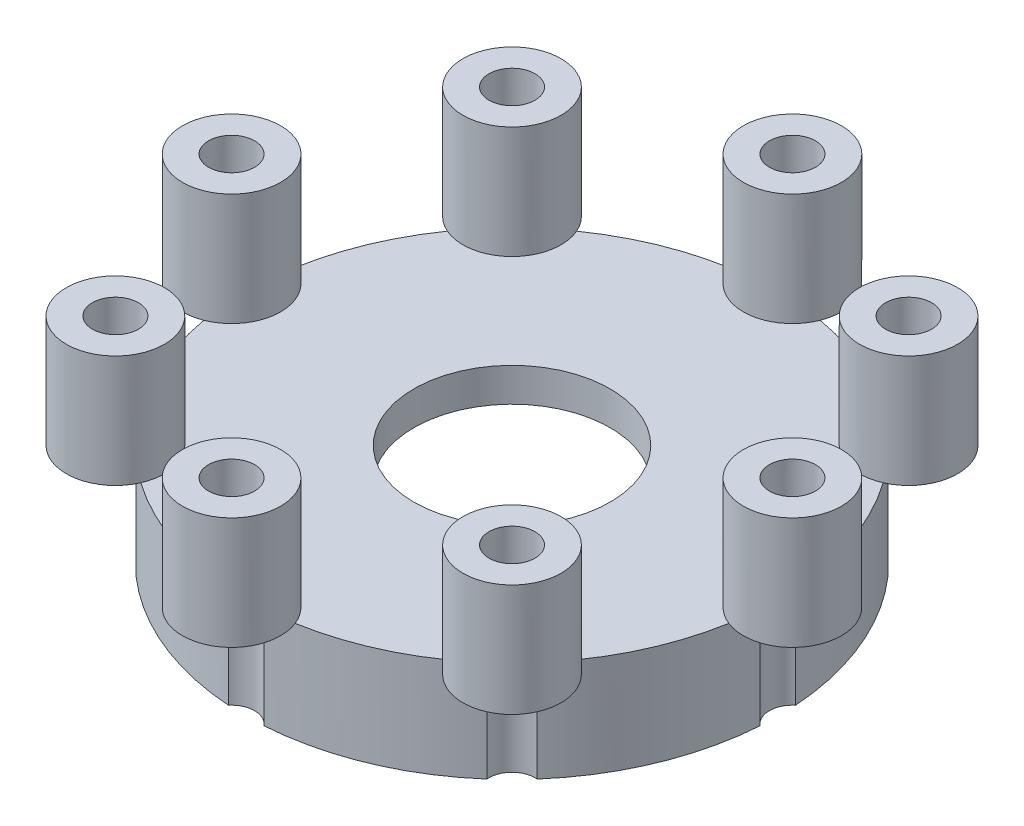
from build123d import *

# Parameters (mm, degrees)
SKETCH3_R               = 8.75
BOSS_EXTRUDE1_DEPTH     = 20
CUT_EXTRUDE1_DEPTH      = 92.362601758
CUT_EXTRUDE1_DEPTH_BACK = 92.362601758
SKETCH4_R               = 4.1
SKETCH5_R               = 6.880501159
CUT_EXTRUDE2_DEPTH      = 10


with BuildPart() as part:
    # Sketch2 → Revolve1 (revolve)
    with BuildSketch(Plane(origin=(0, 0, 0), x_dir=(0, 0, -1), z_dir=(1, 0, 0))):
        Polygon((-47.5, 9), (-47.5, -9), (-42.5, -9), (-42.5, 3), (-17.5, 3), (-17.5, 9), align=None)
    revolve(axis=Axis((0, 40.533381554, 0), (0, -1, 0)))

    # Sketch3 → Boss-Extrude1 (add)
    with BuildSketch(Plane(origin=(0, 9, 0), x_dir=(1, 0, 0), z_dir=(0, 1, 0))):
        with Locations(Location((0, 50, 0), (0, 0, 201.473535129))):
            Circle(SKETCH3_R)
        with Locations(Location((35.355339059, 35.355339059, 0), (0, 0, 156.473535129))):
            Circle(SKETCH3_R)
        with Locations(Location((50, 0, 0), (0, 0, 111.473535129))):
            Circle(SKETCH3_R)
        with Locations(Location((35.355339059, -35.355339059, 0), (0, 0, 66.473535129))):
            Circle(SKETCH3_R)
        with Locations(Location((0, -50, 0), (0, 0, 158.526464871))):
            Circle(SKETCH3_R)
        with Locations(Location((-35.355339059, -35.355339059, 0), (0, 0, 113.526464871))):
            Circle(SKETCH3_R)
        with Locations(Location((-50, 0, 0), (0, 0, 68.526464871))):
            Circle(SKETCH3_R)
        with Locations(Location((-35.355339059, 35.355339059, 0), (0, 0, 23.526464871))):
            Circle(SKETCH3_R)
    extrude(amount=BOSS_EXTRUDE1_DEPTH)

    # Sketch4 → Cut-Extrude1 (cut, two sides: drawn at the far end of the back side and taken through both)
    with BuildSketch(Plane(origin=(0, 29, 0), x_dir=(1, 0, 0), z_dir=(0, 1, 0)).offset(-CUT_EXTRUDE1_DEPTH_BACK)):
        with Locations(Location((0, 50, 0), (0, 0, 270))):
            Circle(SKETCH4_R)
        with Locations(Location((35.355339059, 35.355339059, 0), (0, 0, 270))):
            Circle(SKETCH4_R)
        with Locations(Location((50, 0, 0), (0, 0, 270))):
            Circle(SKETCH4_R)
        with Locations(Location((35.355339059, -35.355339059, 0), (0, 0, 270))):
            Circle(SKETCH4_R)
        with Locations(Location((0, -50, 0), (0, 0, 270))):
            Circle(SKETCH4_R)
        with Locations(Location((-35.355339059, -35.355339059, 0), (0, 0, 270))):
            Circle(SKETCH4_R)
        with Locations(Location((-50, 0, 0), (0, 0, 270))):
            Circle(SKETCH4_R)
        with Locations(Location((-35.355339059, 35.355339059, 0), (0, 0, 270))):
            Circle(SKETCH4_R)
    extrude(amount=CUT_EXTRUDE1_DEPTH + CUT_EXTRUDE1_DEPTH_BACK, mode=Mode.SUBTRACT)

    # Sketch5 → Cut-Extrude2 (cut)
    with BuildSketch(Plane.XZ.offset(-9)):
        with Locations(Location((35.355339059, 35.355339059, 0), (0, 0, 270))):
            Circle(SKETCH5_R)
        with Locations(Location((-35.355339059, 35.355339059, 0), (0, 0, 270))):
            Circle(SKETCH5_R)
        with Locations(Location((-50, 0, 0), (0, 0, 270))):
            Circle(SKETCH5_R)
        with Locations(Location((-35.355339059, -35.355339059, 0), (0, 0, 270))):
            Circle(SKETCH5_R)
        with Locations(Location((0, -50, 0), (0, 0, 270))):
            Circle(SKETCH5_R)
        with Locations(Location((35.355339059, -35.355339059, 0), (0, 0, 270))):
            Circle(SKETCH5_R)
        with Locations(Location((50, 0, 0), (0, 0, 270))):
            Circle(SKETCH5_R)
        with Locations(Location((0, 50, 0), (0, 0, 270))):
            Circle(SKETCH5_R)
    extrude(amount=-CUT_EXTRUDE2_DEPTH, mode=Mode.SUBTRACT)


solid = part.part
